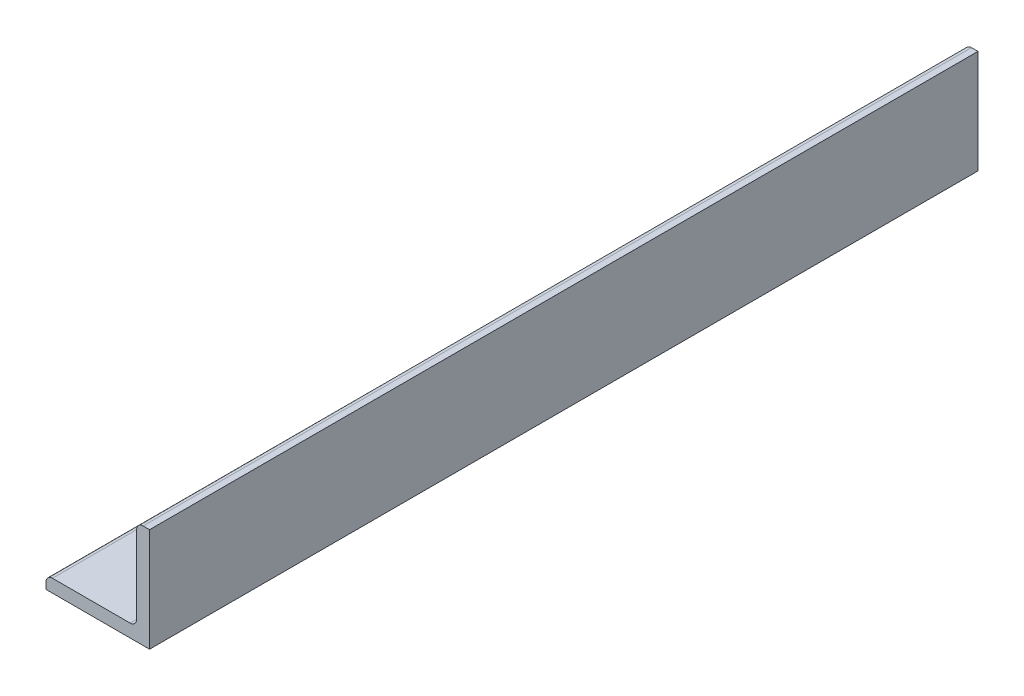
from build123d import *

# Parameters (mm, degrees)
BOSS_EXTRUDE1_DEPTH = 101.6


with BuildPart() as part:
    # Sketch2 → Boss-Extrude1 (new, symmetric)
    with BuildSketch(Plane.XY):
        with BuildLine():
            Line((-12.7, 0), (12.7, 0))
            Line((12.7, 0), (12.7, 25.4))
            Line((12.7, 25.4), (11.1125, 25.4))
            ThreePointArc((11.1125, 25.4), (9.989967985, 24.935032015), (9.525, 23.8125))
            Line((9.525, 23.8125), (9.525, 4.7625))
            ThreePointArc((9.525, 4.7625), (9.060032015, 3.639967985), (7.9375, 3.175))
            Line((7.9375, 3.175), (-11.1125, 3.175))
            ThreePointArc((-11.1125, 3.175), (-12.235032015, 2.710032015), (-12.7, 1.5875))
            Line((-12.7, 1.5875), (-12.7, 0))
        make_face()
    extrude(amount=BOSS_EXTRUDE1_DEPTH, both=True)


solid = part.part
